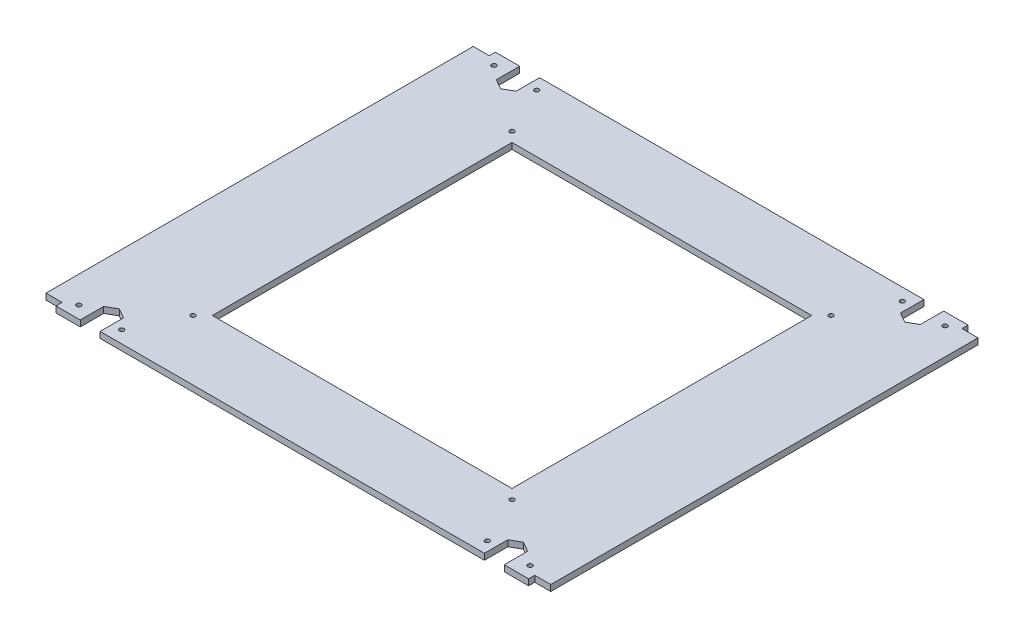
from build123d import *

# Parameters (mm, degrees)
SKETCH1_R           = 1.5
SKETCH1_W           = 196.314766664
SKETCH1_H           = 196.314766664
BOSS_EXTRUDE1_DEPTH = 4


with BuildPart() as part:
    # Sketch1 → Boss-Extrude1 (new body)
    with BuildSketch(Plane(origin=(0, 0, 0), x_dir=(1, 0, 0), z_dir=(0, 1, 0))):
        Polygon((154.855, -139.95), (165.325, -139.95), (165.325, 139.95), (154.855, 139.95), (154.855, 143.95), (138.875, 143.95), (138.875, 128.61722325), (132.375, 124.864446501), (125.875, 128.61722325), (125.875, 143.95), (-125.875, 143.95), (-125.875, 128.61722325), (-132.375, 124.864446501), (-138.875, 128.61722325), (-138.875, 143.95), (-154.855, 143.95), (-154.855, 139.95), (-165.325, 139.95), (-165.325, -139.95), (-154.855, -139.95), (-154.855, -143.95), (-138.875, -143.95), (-138.875, -128.61722325), (-132.375, -124.864446501), (-125.875, -128.61722325), (-125.875, -143.95), (125.875, -143.95), (125.875, -128.61722325), (132.375, -124.864446501), (138.875, -128.61722325), (138.875, -143.95), (154.855, -143.95), align=None)
        with Locations((-147.795, -135.95)):
            Circle(SKETCH1_R, mode=Mode.SUBTRACT)
        with Locations((-119.795, -135.95)):
            Circle(SKETCH1_R, mode=Mode.SUBTRACT)
        with Locations((-104.5, -104.5)):
            Circle(SKETCH1_R, mode=Mode.SUBTRACT)
        with Locations((119.795, -135.95)):
            Circle(SKETCH1_R, mode=Mode.SUBTRACT)
        with Locations((147.795, -135.95)):
            Circle(SKETCH1_R, mode=Mode.SUBTRACT)
        with Locations((104.5, -104.5)):
            Circle(SKETCH1_R, mode=Mode.SUBTRACT)
        with Locations((-104.5, 104.5)):
            Circle(SKETCH1_R, mode=Mode.SUBTRACT)
        with Locations((-147.795, 135.95)):
            Circle(SKETCH1_R, mode=Mode.SUBTRACT)
        with Locations((-119.795, 135.95)):
            Circle(SKETCH1_R, mode=Mode.SUBTRACT)
        Rectangle(SKETCH1_W, SKETCH1_H, mode=Mode.SUBTRACT)
        with Locations((104.5, 104.5)):
            Circle(SKETCH1_R, mode=Mode.SUBTRACT)
        with Locations((119.795, 135.95)):
            Circle(SKETCH1_R, mode=Mode.SUBTRACT)
        with Locations((147.795, 135.95)):
            Circle(SKETCH1_R, mode=Mode.SUBTRACT)
    extrude(amount=BOSS_EXTRUDE1_DEPTH)


solid = part.part
